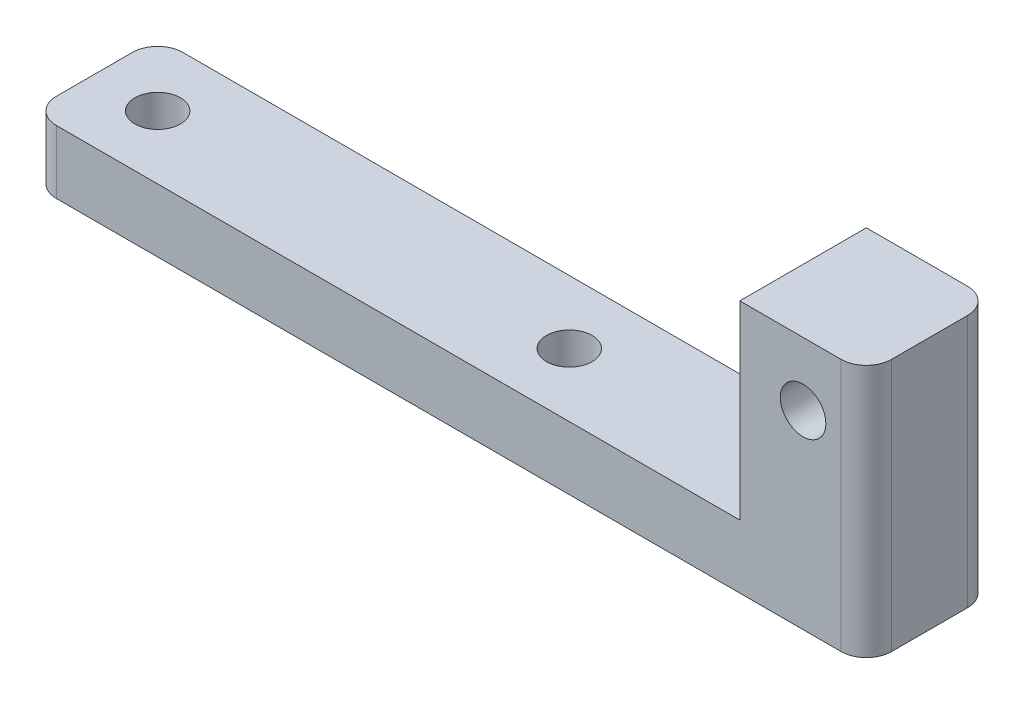
from build123d import *

# Parameters (mm, degrees)
SKETCH1_W           = 83.82
SKETCH1_H           = 12.7
SKETCH1_R           = 2.286
BOSS_EXTRUDE1_DEPTH = 25.4
SKETCH2_R           = 2.286
CUT_EXTRUDE1_DEPTH  = 12.7
FILLET1_R           = 2.54
SKETCH3_W           = 71.12
SKETCH3_H           = 19.05
CUT_EXTRUDE2_DEPTH  = 89.499957062


with BuildPart() as part:
    # Sketch1 → Boss-Extrude1 (new body)
    with BuildSketch(Plane(origin=(0, 0, 0), x_dir=(1, 0, 0), z_dir=(0, 1, 0))):
        with Locations((41.91, 6.35)):
            Rectangle(SKETCH1_W, SKETCH1_H)
        with Locations(Location((6.35, 6.35, 0), (0, 0, 90))):
            Circle(SKETCH1_R, mode=Mode.SUBTRACT)
        with Locations(Location((47.659178157, 6.35, 0), (0, 0, 90))):
            Circle(SKETCH1_R, mode=Mode.SUBTRACT)
    extrude(amount=BOSS_EXTRUDE1_DEPTH)

    # Sketch2 → Cut-Extrude1 (cut)
    with BuildSketch(Plane.XY):
        with Locations((77.47, 19.05)):
            Circle(SKETCH2_R)
    extrude(amount=-CUT_EXTRUDE1_DEPTH, mode=Mode.SUBTRACT)

    # Fillet1
    fillet1_edges = [part.edges().sort_by_distance(p)[0] for p in [
        (0, 12.7, -12.7),
        (83.82, 12.7, -12.7),
        (83.82, 12.7, 0),
        (0, 12.7, 0),
    ]]
    fillet(fillet1_edges, radius=FILLET1_R)

    # Sketch3 → Cut-Extrude2 (cut, through all)
    with BuildSketch(Plane.XY):
        with Locations((35.56, 15.875)):
            Rectangle(SKETCH3_W, SKETCH3_H)
    extrude(amount=-CUT_EXTRUDE2_DEPTH, mode=Mode.SUBTRACT)


solid = part.part
